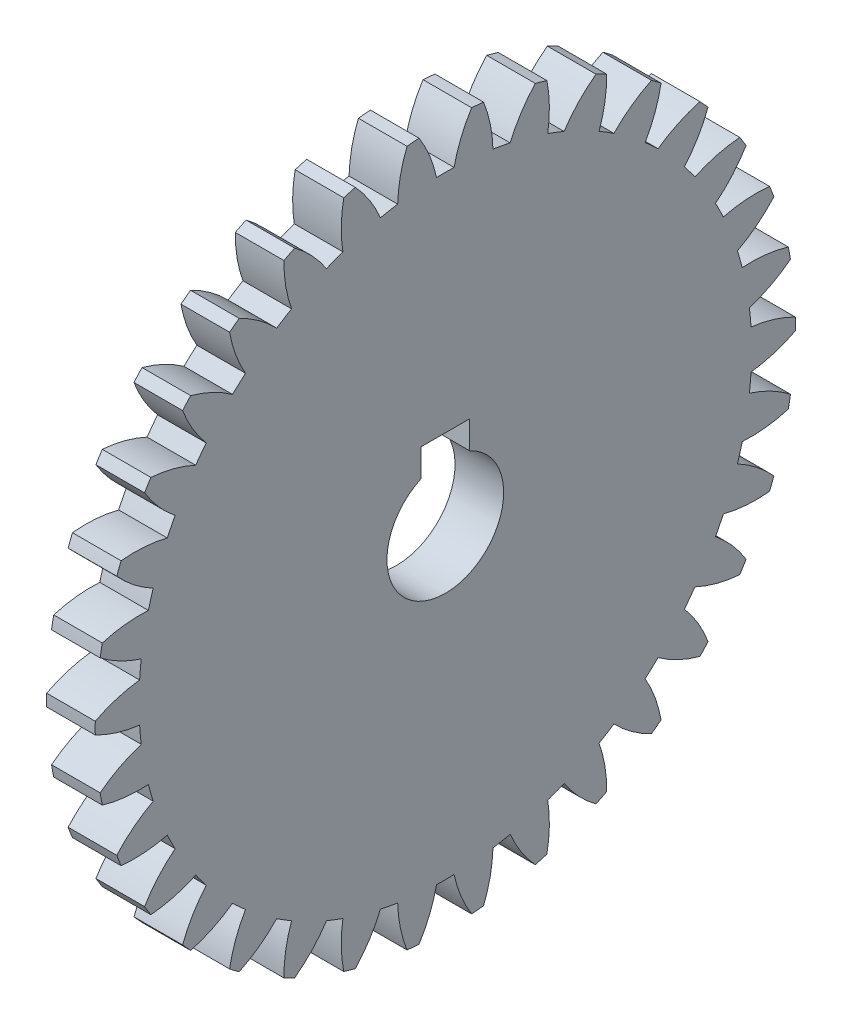
from build123d import *

# Parameters (mm, degrees)
BASPROSKE_W     = 5
BASPROSKE_H     = 36
TOOTHCUT_DEPTH  = 52.15662225
TEETHCUTS_COUNT = 34
TEETHCUTS_ANGLE = 349.411764706
BORSKE_R        = 6
BORE_DEPTH      = 50.0000508
KEYSKE_W        = 5
KEYSKE_H        = 8.3
KEYWAY_DEPTH    = 50.0000508


with BuildPart() as part:
    # BasProSke → Base-Revolve (revolve)
    with BuildSketch(Plane(origin=(0, 0, 0), x_dir=(1, 0, 0), z_dir=(0, 1, 0)), mode=Mode.PRIVATE) as base_revolve_sk:
        with Locations((2.5, 18)):
            Rectangle(BASPROSKE_W, BASPROSKE_H)
    revolve(base_revolve_sk.sketch.rotate(Axis((-10, 0, 0), (1, 0, 0)), 180), axis=Axis((-10, 0, 0), (1, 0, 0)))

    # TooCutSke → ToothCut (cut, through all)
    with BuildSketch(Plane(origin=(0, 0, 0), x_dir=(0, 0, -1), z_dir=(1, 0, 0))):
        with BuildLine():
            ThreePointArc((0.901915747, 31.486085006), (0, 31.499), (-0.901915747, 31.486085006))
            ThreePointArc((-0.901915747, 31.486085006), (-1.615082782, 33.78510684), (-2.722392076, 35.922388931))
            ThreePointArc((-2.722392076, 35.922388931), (0, 36.0254), (2.722392076, 35.922388931))
            ThreePointArc((2.722392076, 35.922388931), (1.615082782, 33.78510684), (0.901915747, 31.486085006))
        make_face()
    toothcut = extrude(amount=TOOTHCUT_DEPTH, mode=Mode.SUBTRACT)

    # TeethCuts: ToothCut ×34 about axis
    teethcuts_axis = Axis((-10, 0, 0), (1, 0, 0))
    for i in range(1, TEETHCUTS_COUNT):
        add(toothcut.rotate(teethcuts_axis, i * TEETHCUTS_ANGLE / (TEETHCUTS_COUNT - 1)), mode=Mode.SUBTRACT)

    # BorSke → Bore (cut, symmetric)
    with BuildSketch(Plane(origin=(0, 0, 0), x_dir=(0, 0, -1), z_dir=(1, 0, 0))):
        with Locations(Location((0, 0, 0), (0, 0, 180))):
            Circle(BORSKE_R)
    extrude(amount=BORE_DEPTH, both=True, mode=Mode.SUBTRACT)

    # KeySke → Keyway (cut, symmetric)
    with BuildSketch(Plane(origin=(0, 0, 0), x_dir=(0, 0, -1), z_dir=(1, 0, 0))):
        with Locations((0, 4.15)):
            Rectangle(KEYSKE_W, KEYSKE_H)
    extrude(amount=KEYWAY_DEPTH, both=True, mode=Mode.SUBTRACT)


solid = part.part
